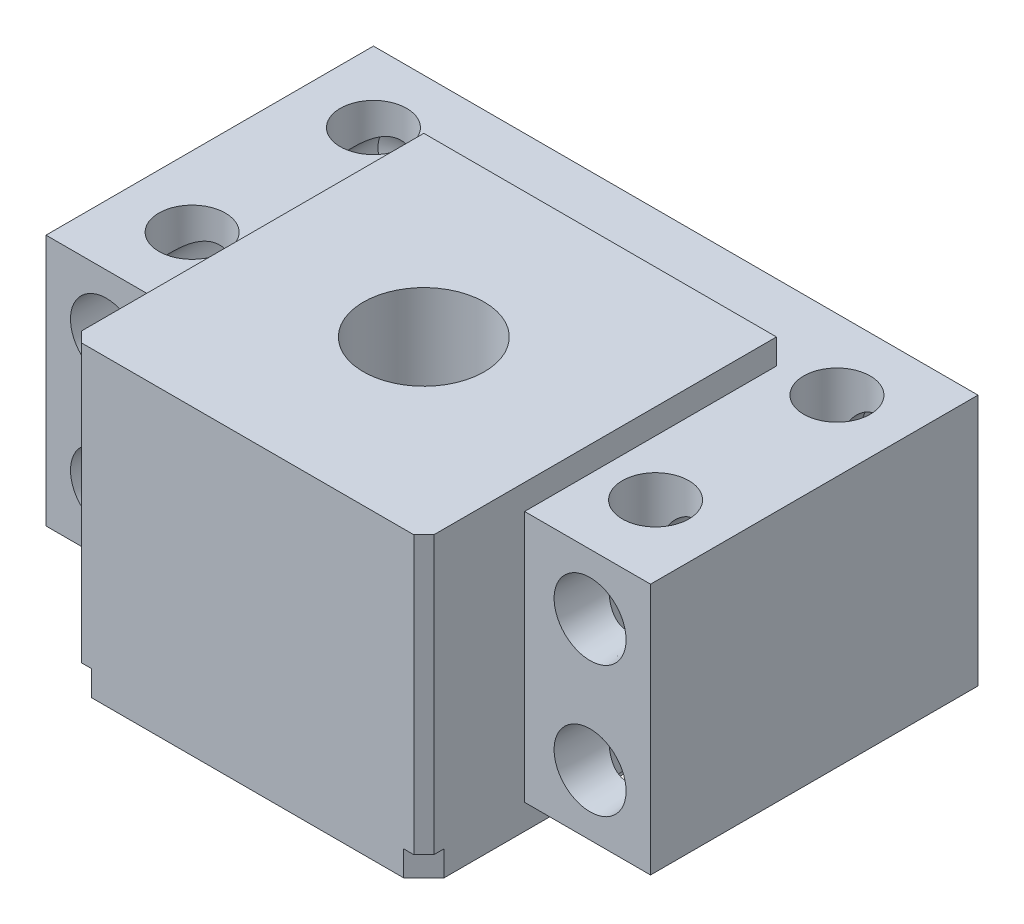
from build123d import *

# Parameters (mm, degrees)
SKETCH_1_W             = 60
SKETCH_1_H             = 25
EXTRUDE_1_DEPTH        = 32.5
SKETCH_2_R             = 3.3
SKETCH_2_R_2           = 3.300235
SKETCH_2_R_3           = 3.300232814
CUT_EXTRUDE_1_DEPTH    = 51.806003582
F_1_16_RC_1_AT_2_COUNT = 2
F_1_16_RC_1_AT_2_PITCH = 13
F_1_16_RC_1_AT_3_COUNT = 2
F_1_16_RC_1_AT_3_PITCH = 48
F_1_16_RC_1_AT_4_COUNT = 2
F_1_16_RC_1_AT_4_PITCH = 49.729267037
SKETCH_5_W             = 35
SKETCH_5_H             = 35
EXTRUDE_2_DEPTH        = 27.5
CHAMFER_1_SIZE         = 1
SKETCH_5_2_W           = 35
SKETCH_5_2_H           = 35
EXTRUDE_3_DEPTH        = 2.5
CHAMFER_2_SIZE         = 2
CUT_EXTRUDE_2_DEPTH    = 2.5
SKETCH_7_R             = 6
CUT_EXTRUDE_3_DEPTH    = 61.052060747


with BuildPart() as part:
    # 스케치1 → 보스-돌출1 (new body)
    with BuildSketch(Plane.XY):
        Rectangle(SKETCH_1_W, SKETCH_1_H)
    extrude(amount=EXTRUDE_1_DEPTH)

    # 스케치2 → 컷-돌출1 (cut, through all)
    with BuildSketch(Plane.XZ.offset(12.5)):
        with Locations(Location((-23, 7, 0), (0, 0, 270))):
            Circle(SKETCH_2_R)
        with Locations(Location((23, 7, 0), (0, 0, 270))):
            Circle(SKETCH_2_R_2)
        with Locations(Location((23, 25, 0), (0, 0, 270))):
            Circle(SKETCH_2_R_2)
        with Locations(Location((-23, 25, 0), (0, 0, 270))):
            Circle(SKETCH_2_R_3)
    extrude(amount=-CUT_EXTRUDE_1_DEPTH, mode=Mode.SUBTRACT)

    # 스케치4 → 1/16 Rc 나사 구멍1 (revolve, cut)
    with BuildSketch(Plane(origin=(-24, 6.5, 32.5), x_dir=(0, -1, 0), z_dir=(1, 0, 0))):
        Polygon((0, 0), (0, 31.832624888), (3.05, 30), (3.05, 7.4), (3.339997004, 7.4), (3.571, 0), align=None)
    f_1_16_rc_1 = revolve(axis=Axis((-24, 6.5, 38.85), (0, 0, -1)), mode=Mode.SUBTRACT)

    # 1/16 Rc 나사 구멍1 at 2: 1/16 Rc 나사 구멍1 ×2
    with Locations(*[(0, -i * F_1_16_RC_1_AT_2_PITCH, 0) for i in range(1, F_1_16_RC_1_AT_2_COUNT)]):
        add(f_1_16_rc_1, mode=Mode.SUBTRACT)

    # 1/16 Rc 나사 구멍1 at 3: 1/16 Rc 나사 구멍1 ×2
    with Locations(*[(i * F_1_16_RC_1_AT_3_PITCH, 0, 0) for i in range(1, F_1_16_RC_1_AT_3_COUNT)]):
        add(f_1_16_rc_1, mode=Mode.SUBTRACT)

    # 1/16 Rc 나사 구멍1 at 4: 1/16 Rc 나사 구멍1 ×2
    with Locations(*[Vector(0.9652263719199435, -0.2614154757283181, 0) * (i * F_1_16_RC_1_AT_4_PITCH) for i in range(1, F_1_16_RC_1_AT_4_COUNT)]):
        add(f_1_16_rc_1, mode=Mode.SUBTRACT)

    # 스케치5 → 보스-돌출2 (add)
    with BuildSketch(Plane.XZ.offset(12.5)):
        with Locations((0, 25)):
            Rectangle(SKETCH_5_W, SKETCH_5_H)
    extrude(amount=-EXTRUDE_2_DEPTH)

    # 모따기1
    chamfer_1_edges = [part.edges().sort_by_distance(p)[0] for p in [
        (-17.5, 1.25, 42.5),
        (17.5, 1.25, 42.5),
    ]]
    chamfer(chamfer_1_edges, length=CHAMFER_1_SIZE)

    # 스케치5<2> → 보스-돌출3 (add)
    with BuildSketch(Plane.XZ.offset(12.5)):
        with Locations((0, 25)):
            Rectangle(SKETCH_5_2_W, SKETCH_5_2_H)
    extrude(amount=EXTRUDE_3_DEPTH)

    # 모따기2
    chamfer_2_edges = [part.edges().sort_by_distance(p)[0] for p in [
        (17.5, -13.75, 7.5),
        (-17.5, -13.75, 7.5),
    ]]
    chamfer(chamfer_2_edges, length=CHAMFER_2_SIZE)

    # 스케치6 → 컷-돌출2 (cut)
    with BuildSketch(Plane.XZ.offset(15)):
        Polygon((-17.5, 40.5), (-15.5, 42.5), (-17.5, 42.5), align=None)
        Polygon((17.5, 42.5), (17.5, 40.5), (15.5, 42.5), align=None)
    extrude(amount=-CUT_EXTRUDE_2_DEPTH, mode=Mode.SUBTRACT)

    # 스케치7 → 컷-돌출3 (cut, through all)
    with BuildSketch(Plane.XZ.offset(15)):
        with Locations(Location((0, 25, 0), (0, 0, 270))):
            Circle(SKETCH_7_R)
    extrude(amount=-CUT_EXTRUDE_3_DEPTH, mode=Mode.SUBTRACT)


solid = part.part
